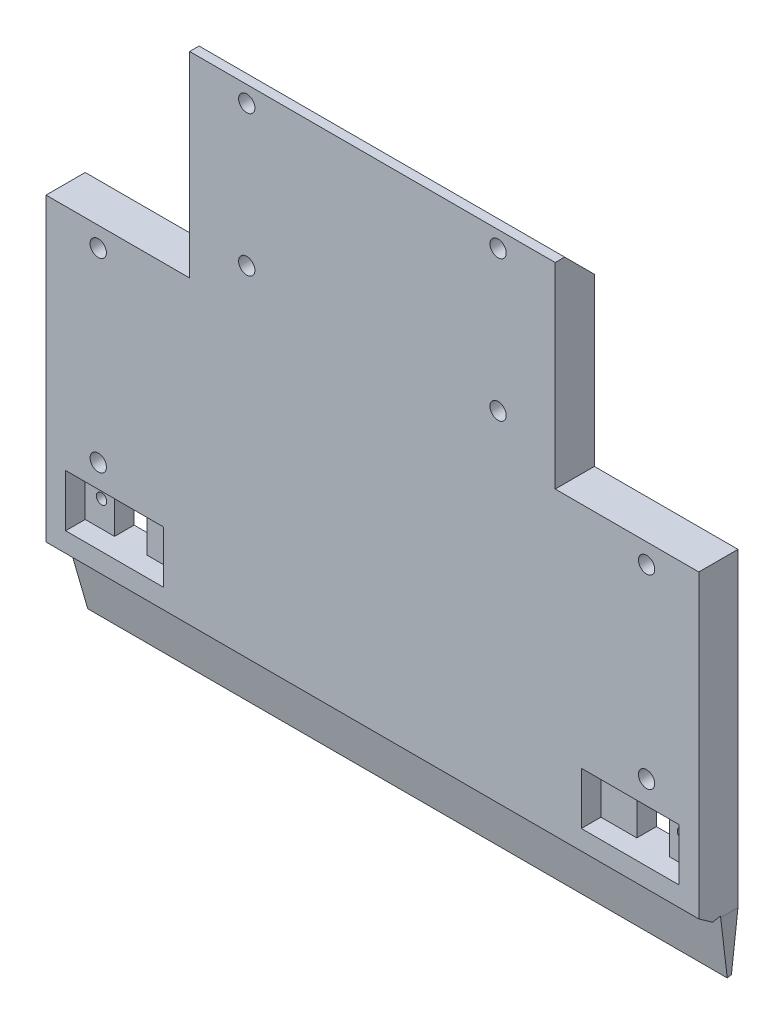
from build123d import *

# Parameters (mm, degrees)
RESSALTO_EXTRUS_O1_DEPTH                = 6
CORTE_EXTRUS_O1_DEPTH                   = 100
CORTE_EXTRUS_O2_DEPTH                   = 100
CORTE_EXTRUS_O3_DEPTH                   = 100
FILETE1_R                               = 0.1
CORTE_EXTRUS_O4_DEPTH                   = 100
BROCA_DE_ROSQUEAR_PARA_TARRAXA_DE_M31_D = 2.5
ESBO_O9_W                               = 15
ESBO_O9_H                               = 8
CORTE_EXTRUS_O5_DEPTH                   = 3
ESBO_O10_W                              = 5
ESBO_O10_H                              = 8
CORTE_EXTRUS_O6_DEPTH                   = 3
BROCA_DE_ROSQUEAR_PARA_TARRAXA_DE_M21_D = 1.6
BROCA_DE_ROSQUEAR_PARA_TARRAXA_DE_M32_D = 2.5
ESBO_O15_W                              = 56.265856886
ESBO_O15_H                              = 5.410018906
CORTE_EXTRUS_O7_DEPTH                   = 5
ESBO_O16_W                              = 22
ESBO_O16_H                              = 2
CORTE_EXTRUS_O8_DEPTH                   = 10
CORTE_EXTRUS_O9_DEPTH                   = 100


with BuildPart() as part:
    # Esboço1 → Ressalto-extrusão1 (new body)
    with BuildSketch(Plane.XY):
        Polygon((0, 62), (22, 62), (22, 96), (78, 96), (78, 62), (100, 62), (100, 0), (0, 0), align=None)
    extrude(amount=RESSALTO_EXTRUS_O1_DEPTH)

    # Esboço2 → Corte-extrusão1 (cut)
    with BuildSketch(Plane.ZY):
        Polygon((0, 0), (2.702851981, 12.71591881), (4.274929738, 12.381763367), (4.34595667, 12.71591881), (6, 12.71591881), (6, 0), align=None)
    extrude(amount=-CORTE_EXTRUS_O1_DEPTH, mode=Mode.SUBTRACT)

    # Esboço3 → Corte-extrusão2 (cut)
    with BuildSketch(Plane(origin=(78, 0, 0), x_dir=(0, 0, -1), z_dir=(1, 0, 0))):
        Polygon((-6, 91.5), (0, 85.5), (0, 96), (-6, 96), align=None)
    extrude(amount=-CORTE_EXTRUS_O2_DEPTH, mode=Mode.SUBTRACT)

    # Esboço4 → Corte-extrusão3 (cut)
    with BuildSketch(Plane(origin=(100, 0, 0), x_dir=(0, 0, -1), z_dir=(1, 0, 0))):
        Polygon((-3.876629102, 12.466424781), (-6, 11.831800832), (-6, 13.966424781), align=None)
    extrude(amount=-CORTE_EXTRUS_O3_DEPTH, mode=Mode.SUBTRACT)

    # Filete1
    filete1_edges = [part.edges().sort_by_distance(p)[0] for p in [
        (50, 0, 0),
    ]]
    fillet(filete1_edges, radius=FILETE1_R)

    # Esboço5 → Corte-extrusão4 (cut)
    with BuildSketch(Plane.XY.offset(6)):
        Polygon((0, 12.466424781), (1.313793103, 0.168697266), (0, 0.851436445), align=None)
        Polygon((100, 12.466424781), (98.686206897, 0.168697266), (100, 0.851436445), align=None)
    extrude(amount=-CORTE_EXTRUS_O4_DEPTH, mode=Mode.SUBTRACT)

    # Broca de rosquear para tarraxa de M31 (through all)
    with Locations(Plane.XY.offset(6)):
        with Locations((92, 56.966424781), (92, 28.520905026), (8, 56.966424781), (8, 28.520905026)):
            Hole(BROCA_DE_ROSQUEAR_PARA_TARRAXA_DE_M31_D / 2)

    # Esboço9 → Corte-extrusão5 (cut)
    with BuildSketch(Plane.XY.offset(6)):
        with Locations((10.5, 20.966424781)):
            Rectangle(ESBO_O9_W, ESBO_O9_H)
        with Locations((89.5, 20.966424781)):
            Rectangle(ESBO_O9_W, ESBO_O9_H)
    extrude(amount=-CORTE_EXTRUS_O5_DEPTH, mode=Mode.SUBTRACT)

    # Esboço10 → Corte-extrusão6 (cut)
    with BuildSketch(Plane(origin=(0, 0, 0), x_dir=(-1, 0, 0), z_dir=(0, 0, -1))):
        with Locations((-90, 20.966424781)):
            Rectangle(ESBO_O10_W, ESBO_O10_H)
        with Locations((-10, 20.966424781)):
            Rectangle(ESBO_O10_W, ESBO_O10_H)
    extrude(amount=-CORTE_EXTRUS_O6_DEPTH, mode=Mode.SUBTRACT)

    # Broca de rosquear para tarraxa de M21 (through all)
    with Locations(Plane.XY.offset(3)):
        with Locations((5.4999996, 20.966424401), (94.5000004, 20.966425161)):
            Hole(BROCA_DE_ROSQUEAR_PARA_TARRAXA_DE_M21_D / 2)

    # Broca de rosquear para tarraxa de M32 (through all)
    with Locations(Plane(origin=(0, 0, 0), x_dir=(-1, 0, 0), z_dir=(0, 0, -1))):
        with Locations((-30.75, 66), (-69.25, 66), (-69.25, 87.551471863), (-30.75, 87.551471863)):
            Hole(BROCA_DE_ROSQUEAR_PARA_TARRAXA_DE_M32_D / 2)

    # Esboço15 → Corte-extrusão7 (cut)
    with BuildSketch(Plane.XY.offset(6)):
        with Locations((50.132928443, 92.756481316)):
            Rectangle(ESBO_O15_W, ESBO_O15_H)
    extrude(amount=-CORTE_EXTRUS_O7_DEPTH, mode=Mode.SUBTRACT)

    # Esboço16 → Corte-extrusão8 (cut)
    with BuildSketch(Plane(origin=(0, 0, 0), x_dir=(-1, 0, 0), z_dir=(0, 0, -1))):
        with Locations((-11, 61)):
            Rectangle(ESBO_O16_W, ESBO_O16_H)
        with Locations((-89, 61)):
            Rectangle(ESBO_O16_W, ESBO_O16_H)
    extrude(amount=-CORTE_EXTRUS_O8_DEPTH, mode=Mode.SUBTRACT)

    # Esboço17 → Corte-extrusão9 (cut)
    with BuildSketch(Plane.ZY):
        Polygon((0.623735072, 2.934442802), (0, 3.067021785), (0, 0), align=None)
    extrude(amount=-CORTE_EXTRUS_O9_DEPTH, mode=Mode.SUBTRACT)


solid = part.part
